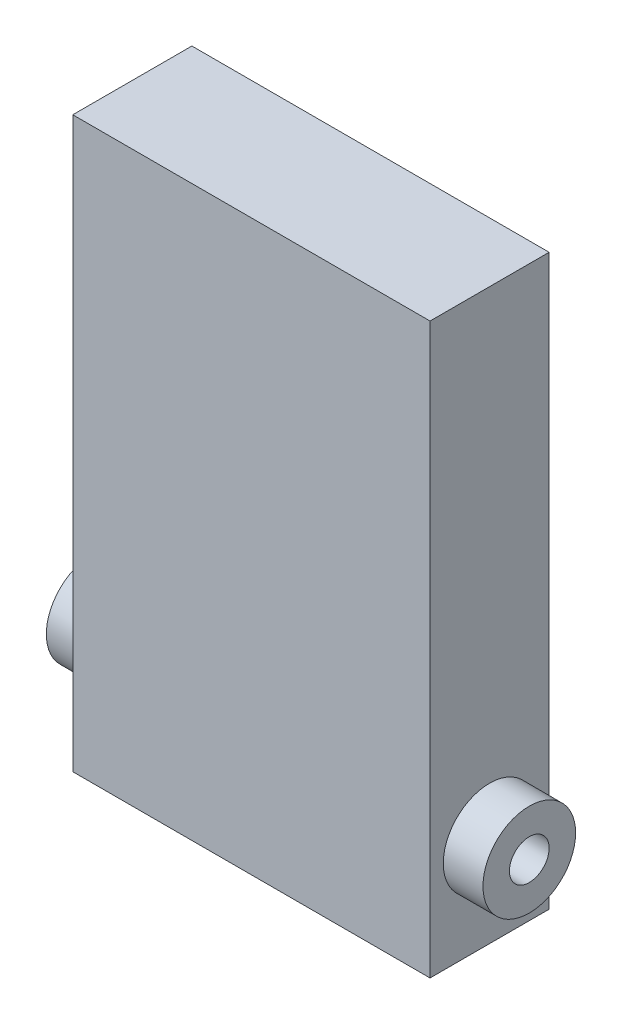
from build123d import *

# Parameters (mm, degrees)
CROQUIS1_W              = 27
CROQUIS1_H              = 43
SALIENTE_EXTRUIR1_DEPTH = 4.5
CROQUIS2_R              = 3.5
SALIENTE_EXTRUIR2_DEPTH = 3
CROQUIS3_R              = 1.5
CORTAR_EXTRUIR1_DEPTH   = 5


with BuildPart() as part:
    # Croquis1 → Saliente-Extruir1 (new, symmetric)
    with BuildSketch(Plane.XY):
        Rectangle(CROQUIS1_W, CROQUIS1_H)
    extrude(amount=SALIENTE_EXTRUIR1_DEPTH, both=True)

    # Croquis2 → Saliente-Extruir2 (add)
    with BuildSketch(Plane(origin=(13.5, 0, 0), x_dir=(0, 0, -1), z_dir=(1, 0, 0))):
        with Locations(Location((0, -14.5, 0), (0, 0, 180))):
            Circle(CROQUIS2_R)
    saliente_extruir2 = extrude(amount=SALIENTE_EXTRUIR2_DEPTH)

    # Croquis3 → Cortar-Extruir1 (cut)
    with BuildSketch(Plane(origin=(16.5, 0, 0), x_dir=(0, 0, -1), z_dir=(1, 0, 0))):
        with Locations((0, -14.5)):
            Circle(CROQUIS3_R)
    cortar_extruir1 = extrude(amount=-CORTAR_EXTRUIR1_DEPTH, mode=Mode.SUBTRACT)

    # Simetría2: Saliente-Extruir2, Cortar-Extruir1 across plane
    add(saliente_extruir2.mirror(Plane(origin=(0, 0, 0), x_dir=(0, 0, 1), z_dir=(1, 0, 0))))
    add(cortar_extruir1.mirror(Plane(origin=(0, 0, 0), x_dir=(0, 0, 1), z_dir=(1, 0, 0))), mode=Mode.SUBTRACT)


solid = part.part
